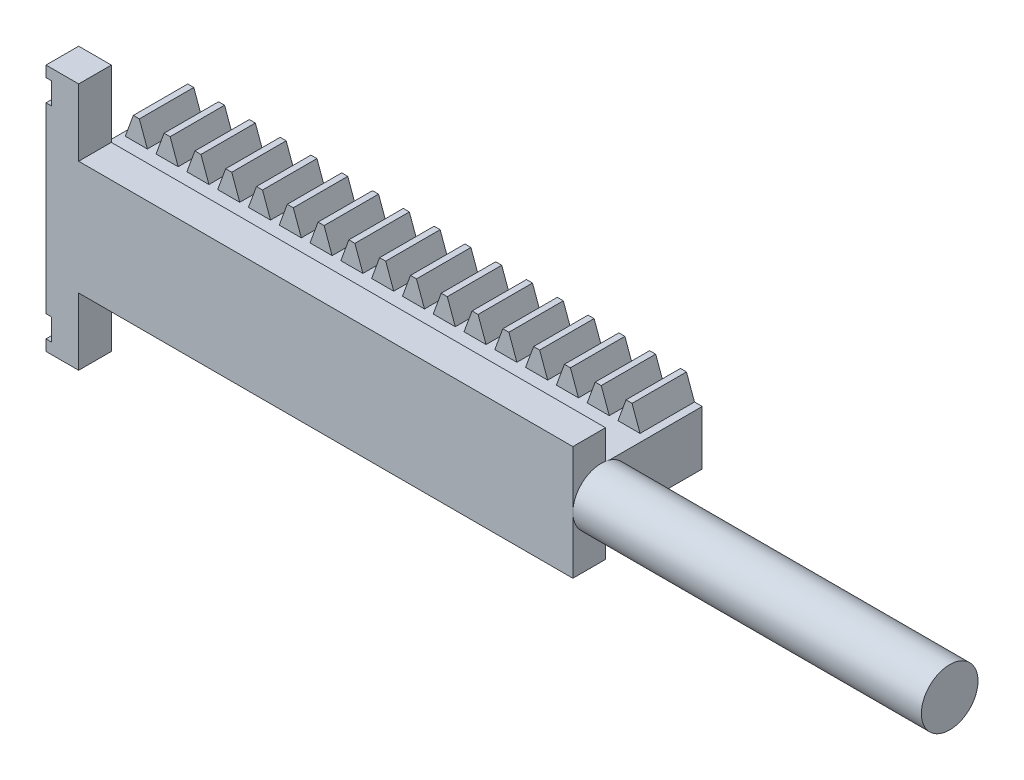
from build123d import *

# Parameters (mm, degrees)
BLANKSKE_W          = 48.375
BLANKSKE_H          = 7
BLANK_DEPTH         = 5
TOOTHCUTSIM_DEPTH   = 50.133905045
TEETHCUTS_COUNT     = 18
TEETHCUTS_PITCH     = 2.827433385
SKETCH7_W           = 6.878661204
SKETCH7_H           = 4.975
BOSS_EXTRUDE5_DEPTH = 48.375
SKETCH8_R           = 2.6
BOSS_EXTRUDE6_DEPTH = 32
SKETCH10_W          = 3
SKETCH10_H          = 2.75
BOSS_EXTRUDE8_DEPTH = 48.375
SKETCH11_W          = 3
SKETCH11_H          = 3
BOSS_EXTRUDE9_DEPTH = 6.15
SKETCH12_W          = 3
SKETCH12_H          = 2
CUT_EXTRUDE1_DEPTH  = 0.5


with BuildPart() as part:
    # BlankSke → Blank (new body)
    with BuildSketch(Plane.XY):
        with Locations((24.1875, 3.5)):
            Rectangle(BLANKSKE_W, BLANKSKE_H)
    extrude(amount=-BLANK_DEPTH)

    # TooCutSkeSim → ToothCutSim (cut, through all)
    with BuildSketch(Plane.XY):
        Polygon((0.399391833, 4.975), (-0.399391833, 4.975), (-1.145676401, 7.0254), (1.145676401, 7.0254), align=None)
    toothcutsim = extrude(amount=-TOOTHCUTSIM_DEPTH, mode=Mode.SUBTRACT)

    # TeethCuts: ToothCutSim ×18
    with Locations(*[(i * TEETHCUTS_PITCH, 0, 0) for i in range(1, TEETHCUTS_COUNT)]):
        add(toothcutsim, mode=Mode.SUBTRACT)

    # Sketch7 → Boss-Extrude5 (add)
    with BuildSketch(Plane(origin=(48.375, 0, 0), x_dir=(0, 0, -1), z_dir=(1, 0, 0))):
        with Locations((-3.439330602, 2.4875)):
            Rectangle(SKETCH7_W, SKETCH7_H)
    extrude(amount=-BOSS_EXTRUDE5_DEPTH)

    # Sketch8 → Boss-Extrude6 (add)
    with BuildSketch(Plane(origin=(48.375, 0, 0), x_dir=(0, 0, -1), z_dir=(1, 0, 0))):
        with Locations(Location((-4.278661804, 2.489267286, 0), (0, 0, 180))):
            Circle(SKETCH8_R)
    extrude(amount=BOSS_EXTRUDE6_DEPTH)

    # Sketch10 → Boss-Extrude8 (add)
    with BuildSketch(Plane.ZY):
        with Locations((5.378661204, 6.35)):
            Rectangle(SKETCH10_W, SKETCH10_H)
    boss_extrude8 = extrude(amount=-BOSS_EXTRUDE8_DEPTH)

    # Mirror6: Boss-Extrude8 across plane
    add(boss_extrude8.mirror(Plane.ZX.offset(2.4875)))

    # Sketch11 → Boss-Extrude9 (add)
    with BuildSketch(Plane.XZ.offset(2.75)):
        with Locations((1.5, 5.378661204)):
            Rectangle(SKETCH11_W, SKETCH11_H)
    boss_extrude9 = extrude(amount=BOSS_EXTRUDE9_DEPTH)

    # Mirror7: Boss-Extrude9 across plane
    add(boss_extrude9.mirror(Plane.ZX.offset(2.4875)))

    # Sketch12 → Cut-Extrude1 (cut)
    with BuildSketch(Plane.ZY):
        with Locations((5.378661204, -6.9)):
            Rectangle(SKETCH12_W, SKETCH12_H)
    cut_extrude1 = extrude(amount=-CUT_EXTRUDE1_DEPTH, mode=Mode.SUBTRACT)

    # Mirror8: Cut-Extrude1 across plane
    add(cut_extrude1.mirror(Plane.ZX.offset(2.4875)), mode=Mode.SUBTRACT)


solid = part.part
